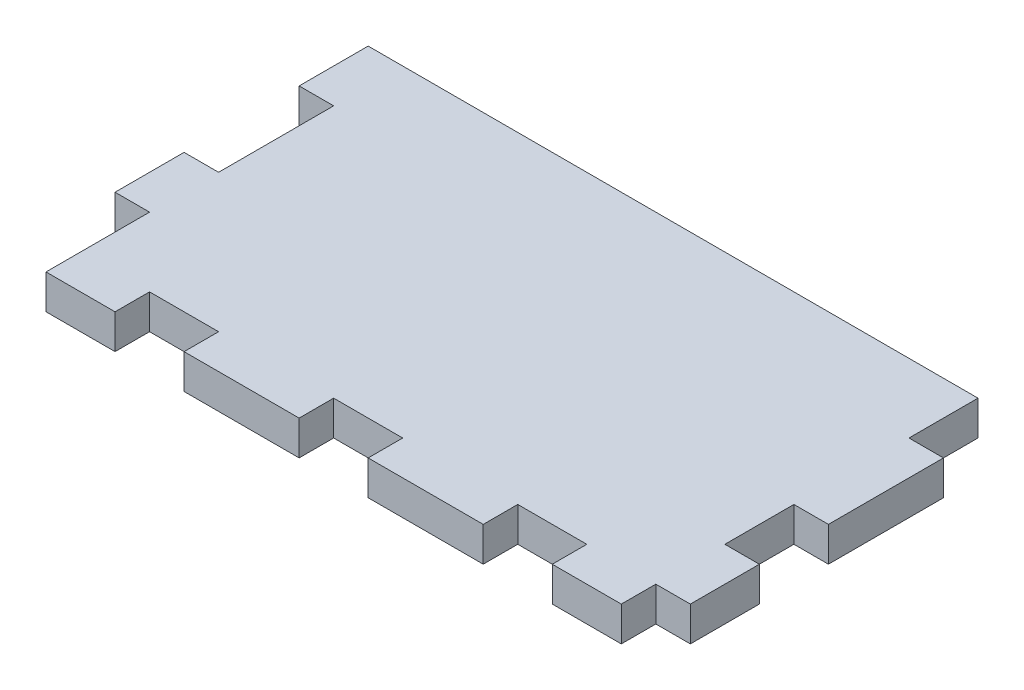
from build123d import *

# Parameters (mm, degrees)
BOSS_EXTRUDE1_DEPTH = 3
SKETCH2_W           = 56
SKETCH2_H           = 25
CUT_EXTRUDE1_DEPTH  = 76.013332148


with BuildPart() as part:
    # Sketch1 → Boss-Extrude1 (new body)
    with BuildSketch(Plane(origin=(0, 0, 0), x_dir=(1, 0, 0), z_dir=(0, 1, 0))):
        Polygon((0, -3), (0, 0), (3, 0), (3, 6), (0, 6), (0, 12), (3, 12), (3, 22), (0, 22), (0, 28), (3, 28), (3, 38), (0, 38), (0, 44), (3, 44), (3, 50), (0, 50), (0, 53), (-6, 53), (-6, 50), (-12, 50), (-12, 53), (-22, 53), (-22, 50), (-28, 50), (-28, 53), (-38, 53), (-38, 50), (-44, 50), (-44, 53), (-50, 53), (-50, 44), (-53, 44), (-53, 38), (-50, 38), (-50, 28), (-53, 28), (-53, 22), (-50, 22), (-50, 12), (-53, 12), (-53, 6), (-50, 6), (-50, -3), (-44, -3), (-44, 0), (-38, 0), (-38, -3), (-28, -3), (-28, 0), (-22, 0), (-22, -3), (-12, -3), (-12, 0), (-6, 0), (-6, -3), align=None)
    extrude(amount=BOSS_EXTRUDE1_DEPTH)

    # Sketch2 → Cut-Extrude1 (cut, through all)
    with BuildSketch(Plane(origin=(0, 3, 0), x_dir=(1, 0, 0), z_dir=(0, 1, 0))):
        with Locations((-25, 40.5)):
            Rectangle(SKETCH2_W, SKETCH2_H)
    extrude(amount=-CUT_EXTRUDE1_DEPTH, mode=Mode.SUBTRACT)


solid = part.part
